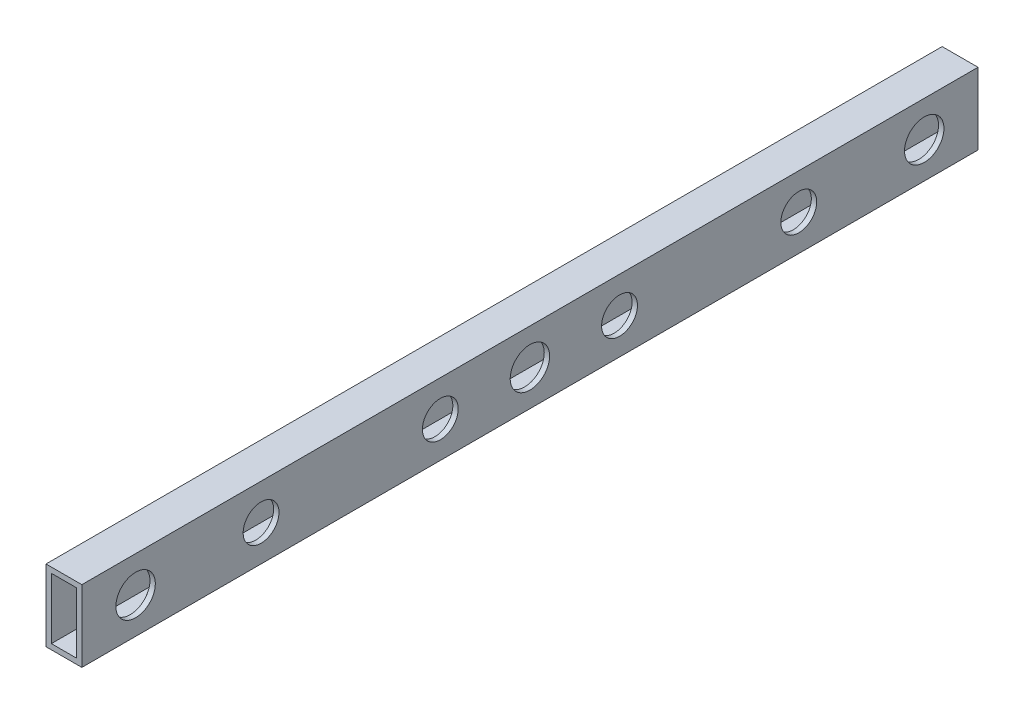
from build123d import *

# Parameters (mm, degrees)
SKETCH_1_W                  = 10
SKETCH_1_H                  = 20
SKETCH_1_W_2                = 7
SKETCH_1_H_2                = 17
EXTRUDE_1_DEPTH             = 250
HOLE_WIZARD_M61_D           = 6.6
HOLE_WIZARD_M61_CBORE_D     = 11
HOLE_WIZARD_M61_CBORE_DEPTH = 6.4
HOLE_WIZARD_1_D             = 10
HOLE_WIZARD_1_DEPTH         = 100


with BuildPart() as part:
    # Эскиз1 → Вытянуть-Тонкостенный1 (new body)
    with BuildSketch(Plane.XY):
        with Locations((5, 10)):
            Rectangle(SKETCH_1_W, SKETCH_1_H)
        with Locations((5, 10)):
            Rectangle(SKETCH_1_W_2, SKETCH_1_H_2, mode=Mode.SUBTRACT)
    extrude(amount=EXTRUDE_1_DEPTH)

    # Цековка для  винта с внутренним шестигранником M61 (through all)
    with Locations(Plane(origin=(10, 0, 0), x_dir=(0, 0, -1), z_dir=(1, 0, 0))):
        with Locations((-235, 10), (-125, 10), (-15, 10)):
            CounterBoreHole(HOLE_WIZARD_M61_D / 2, HOLE_WIZARD_M61_CBORE_D / 2, HOLE_WIZARD_M61_CBORE_DEPTH)

    # Отверстие1
    with Locations(Plane.ZY):
        with Locations((50, 10), (100, 10), (150, 10), (200, 10)):
            Hole(HOLE_WIZARD_1_D / 2, depth=HOLE_WIZARD_1_DEPTH)


solid = part.part
